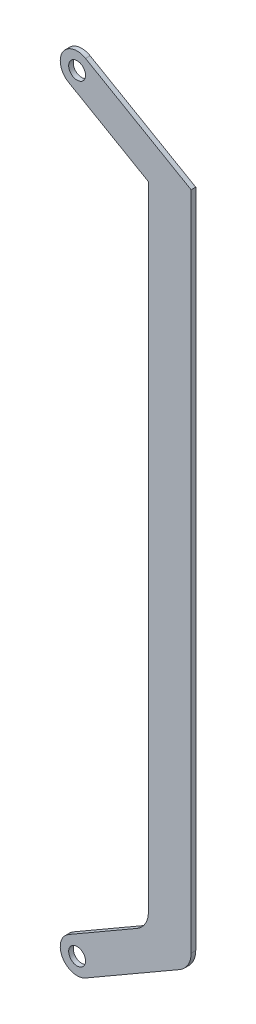
from build123d import *

# Parameters (mm, degrees)
SKETCH_1_R      = 5.5
EXTRUDE_1_DEPTH = 3


with BuildPart() as part:
    # 草图1 → 凸台-拉伸1 (new body)
    with BuildSketch(Plane.XY):
        with BuildLine():
            Line((324.289682364, 18.881027034), (324.289682364, 433.044836172))
            Line((324.289682364, 433.044836172), (324.289682364, 445.746542094))
            Line((324.289682364, 445.746542094), (255.453360513, 485.489211044))
            ThreePointArc((255.453360513, 485.489211044), (240.427081072, 481.462931603), (244.453360513, 466.436652161))
            Line((244.453360513, 466.436652161), (296.41488474, 436.436652161))
            Line((296.41488474, 436.436652161), (296.41488474, 24.149465082))
            ThreePointArc((296.41488474, 24.149465082), (294.405265797, 16.649465082), (288.91488474, 11.159084025))
            Line((288.91488474, 11.159084025), (244.453360513, -14.510788956))
            ThreePointArc((244.453360513, -14.510788956), (240.427081072, -29.537068397), (255.453360513, -33.563347839))
            Line((255.453360513, -33.563347839), (316.789682364, 1.849194092))
            ThreePointArc((316.789682364, 1.849194092), (322.28006342, 7.339575149), (324.289682364, 14.839575149))
            Line((324.289682364, 14.839575149), (324.289682364, 18.881027034))
        make_face()
        with Locations((249.953360513, -24.037068397)):
            Circle(SKETCH_1_R, mode=Mode.SUBTRACT)
        with Locations((249.953360513, 475.962931603)):
            Circle(SKETCH_1_R, mode=Mode.SUBTRACT)
    extrude(amount=EXTRUDE_1_DEPTH)


solid = part.part
